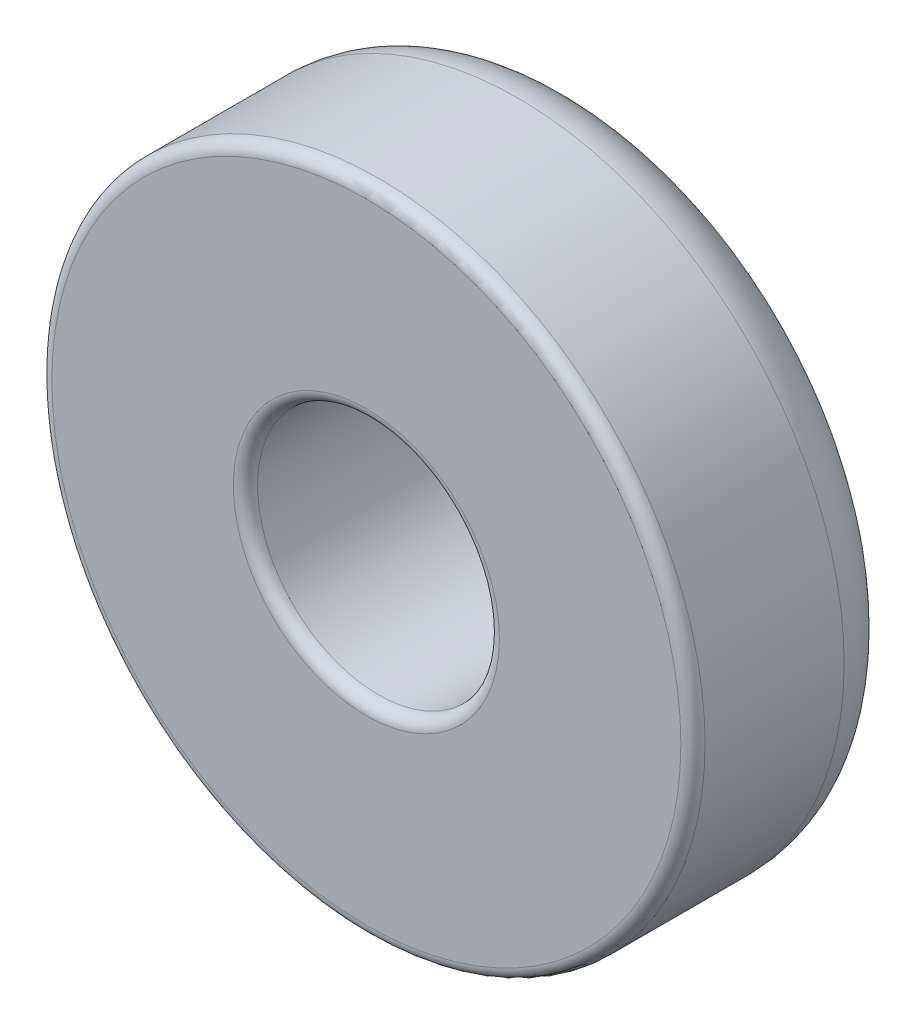
from build123d import *

# Parameters (mm, degrees)
SKETCH1_R           = 2.7
SKETCH1_R_2         = 1
EXTRUDE_THIN1_DEPTH = 1.75
FILLET1_R           = 0.5
FILLET2_R           = 0.1


with BuildPart() as part:
    # Sketch1 → Extrude-Thin1 (new body)
    with BuildSketch(Plane.XY):
        Circle(SKETCH1_R)
        Circle(SKETCH1_R_2, mode=Mode.SUBTRACT)
    extrude(amount=EXTRUDE_THIN1_DEPTH)

    # Fillet1
    fillet1_edges = [part.edges().sort_by_distance(p)[0] for p in [
        (-2.7, 0, 0),
    ]]
    fillet(fillet1_edges, radius=FILLET1_R)

    # Fillet2
    fillet2_edges = [part.edges().sort_by_distance(p)[0] for p in [
        (-1, 0, 0),
        (-2.7, 0, 1.75),
        (-1, 0, 1.75),
    ]]
    fillet(fillet2_edges, radius=FILLET2_R)


solid = part.part
